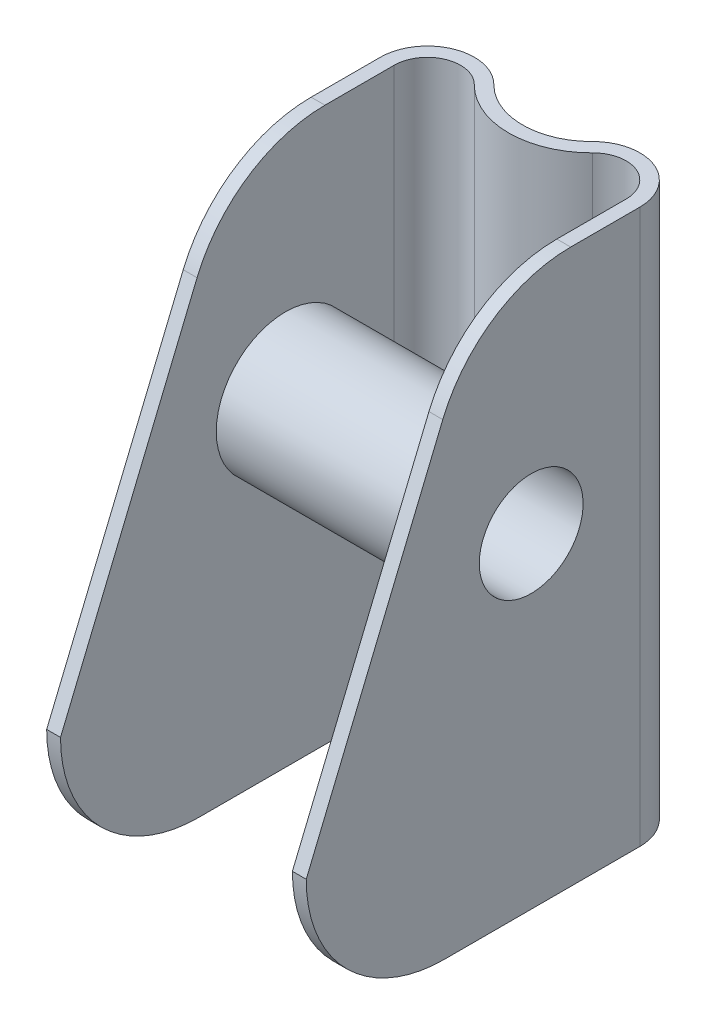
from build123d import *

# Parameters (mm, degrees)
EXTRUDE_THIN1_DEPTH = 101.6
SKETCH3_R           = 9.525
EXTRUDE1_DEPTH      = 101.6
SKETCH2_R           = 12.7
SKETCH2_R_2         = 9.525
EXTRUDE2_DEPTH      = 45.085
EXTRUDE3_DEPTH      = 101.6


with BuildPart() as part:
    # Sketch1 → Extrude-Thin1 (new body)
    with BuildSketch(Plane(origin=(0, 0, 0), x_dir=(1, 0, 0), z_dir=(0, 1, 0))):
        with BuildLine():
            Line((0, 0), (0, 61.221397696))
            ThreePointArc((0, 61.221397696), (5.35372705, 69.204377703), (14.771330869, 67.281072892))
            ThreePointArc((14.771330869, 67.281072892), (23.8125, 63.5), (32.853669131, 67.281072892))
            ThreePointArc((32.853669131, 67.281072892), (42.27127295, 69.204377703), (47.625, 61.221397696))
            Line((47.625, 61.221397696), (47.625, 0))
            Line((47.625, 0), (45.085, 0))
            Line((45.085, 0), (45.085, 61.221397696))
            ThreePointArc((45.085, 61.221397696), (41.307248552, 66.854429414), (34.661902957, 65.497287471))
            ThreePointArc((34.661902957, 65.497287471), (23.8125, 60.96), (12.963097043, 65.497287471))
            ThreePointArc((12.963097043, 65.497287471), (6.317751448, 66.854429414), (2.54, 61.221397696))
            Line((2.54, 61.221397696), (2.54, 0))
            Line((2.54, 0), (0, 0))
        make_face()
    extrude(amount=-EXTRUDE_THIN1_DEPTH)

    # Sketch3 → Extrude1 (cut)
    with BuildSketch(Plane.ZY):
        with Locations((-41.275, -41.91)):
            Circle(SKETCH3_R)
    extrude(amount=-EXTRUDE1_DEPTH, mode=Mode.SUBTRACT)

    # Sketch2 → Extrude2 (add)
    with BuildSketch(Plane.ZY):
        with Locations((-41.275, -41.91)):
            Circle(SKETCH2_R)
        with Locations((-41.275, -41.91)):
            Circle(SKETCH2_R_2, mode=Mode.SUBTRACT)
    extrude(amount=-EXTRUDE2_DEPTH)

    # Sketch4 → Extrude3 (cut)
    with BuildSketch(Plane.ZY):
        with BuildLine():
            Line((-25.053018977, -15.684280765), (0, -76.2))
            Line((0, -76.2), (0, 0))
            Line((0, 0), (-48.521397696, 0))
            ThreePointArc((-48.521397696, 0), (-34.407915996, -4.282006859), (-25.053018977, -15.684280765))
        make_face()
        with BuildLine():
            ThreePointArc((0, -76.2), (-7.439487758, -94.160512242), (-25.4, -101.6))
            Line((-25.4, -101.6), (0, -101.6))
            Line((0, -101.6), (0, -76.2))
        make_face()
    extrude(amount=-EXTRUDE3_DEPTH, mode=Mode.SUBTRACT)


solid = part.part
